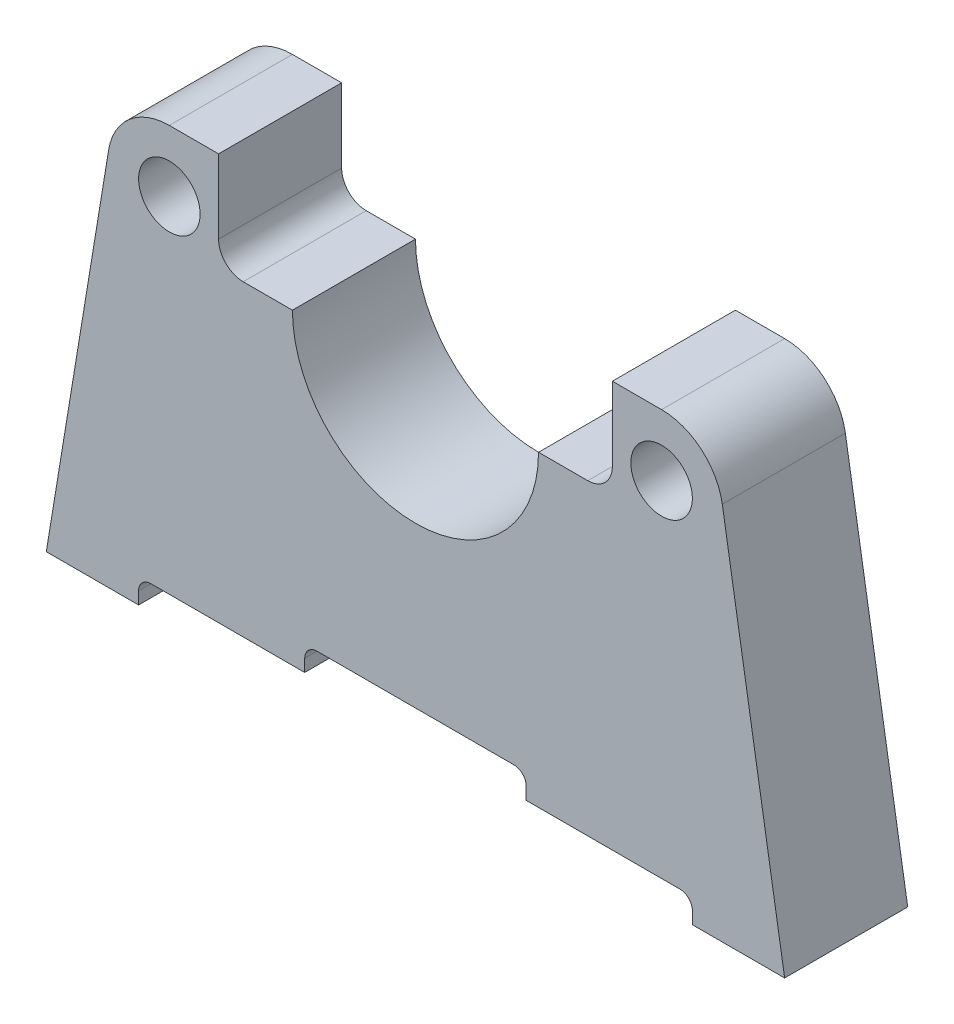
from build123d import *

# Parameters (mm, degrees)
SKETCH1_R           = 2.5
BOSS_EXTRUDE1_DEPTH = 10


with BuildPart() as part:
    # Sketch1 → Boss-Extrude1 (new body)
    with BuildSketch(Plane.XY):
        with BuildLine():
            Line((-30, 0), (-22.5, 0))
            Line((-22.5, 0), (-22.5, 1))
            ThreePointArc((-22.5, 1), (-22.207106781, 1.707106781), (-21.5, 2))
            Line((-21.5, 2), (-9, 2))
            Line((-9, 2), (-9, 3))
            ThreePointArc((-9, 3), (-8.707106781, 3.707106781), (-8, 4))
            Line((-8, 4), (8, 4))
            ThreePointArc((8, 4), (8.707106781, 3.707106781), (9, 3))
            Line((9, 3), (9, 2))
            Line((9, 2), (21.5, 2))
            ThreePointArc((21.5, 2), (22.207106781, 1.707106781), (22.5, 1))
            Line((22.5, 1), (22.5, 0))
            Line((22.5, 0), (30, 0))
            Line((30, 0), (24.933748499, 30.8112495))
            ThreePointArc((24.933748499, 30.8112495), (23.236027851, 33.811577593), (20, 35))
            Line((20, 35), (16, 35))
            Line((16, 35), (16, 29))
            ThreePointArc((16, 29), (15.414213562, 27.585786438), (14, 27))
            Line((14, 27), (10, 27))
            ThreePointArc((10, 27), (0, 17), (-10, 27))
            Line((-10, 27), (-14, 27))
            ThreePointArc((-14, 27), (-15.414213562, 27.585786438), (-16, 29))
            Line((-16, 29), (-16, 35))
            Line((-16, 35), (-20, 35))
            ThreePointArc((-20, 35), (-23.236027851, 33.811577593), (-24.933748499, 30.8112495))
            Line((-24.933748499, 30.8112495), (-30, 0))
        make_face()
        with Locations((-20, 30)):
            Circle(SKETCH1_R, mode=Mode.SUBTRACT)
        with Locations(Location((20, 30, 0), (0, 0, 180))):
            Circle(SKETCH1_R, mode=Mode.SUBTRACT)
    extrude(amount=BOSS_EXTRUDE1_DEPTH)


solid = part.part
